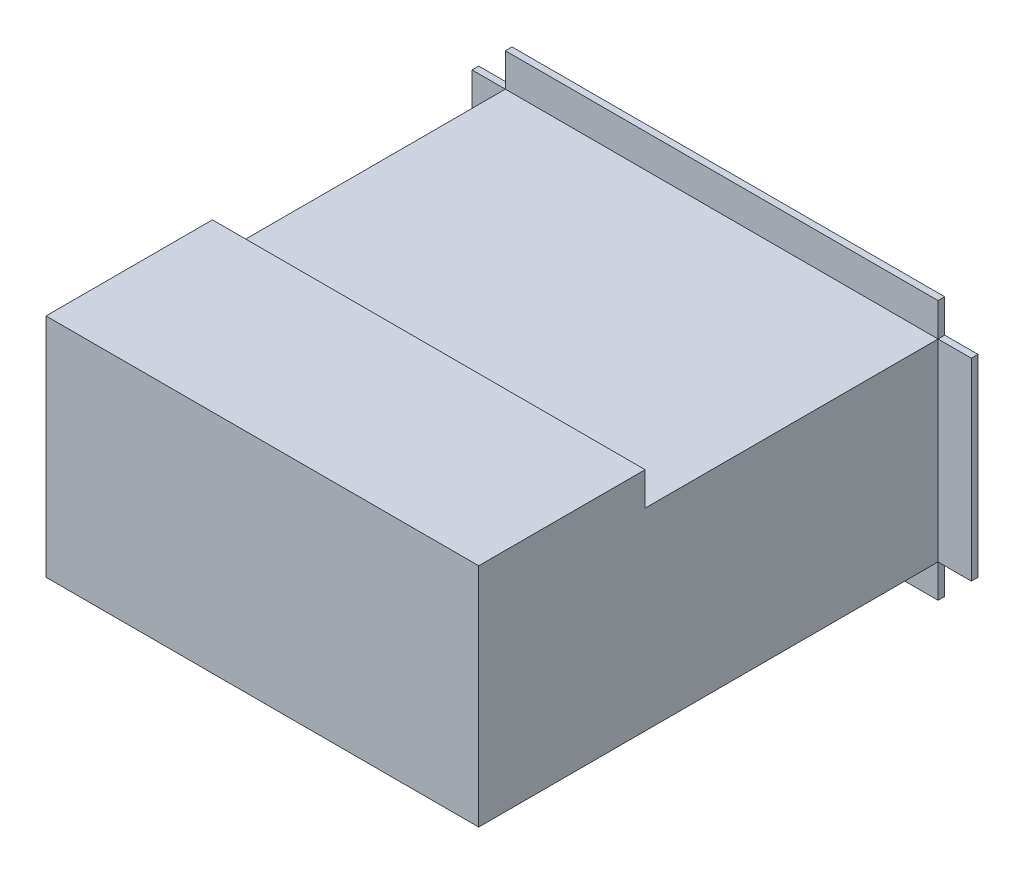
from build123d import *

# Parameters (mm, degrees)
SKETCH_1_W          = 13
SKETCH_1_H          = 6.8
EXTRUDE_1_DEPTH     = 14
SKETCH_3_W          = 13
SKETCH_3_H          = 8.8
CUT_EXTRUDE_1_DEPTH = 1
EXTRUDE_2_DEPTH     = 0.2
SKETCH_6_W          = 12.6
SKETCH_6_H          = 5.4
CUT_EXTRUDE_2_DEPTH = 9
SKETCH_7_W          = 10
SKETCH_7_H          = 2
EXTRUDE_3_DEPTH     = 8.5
CHAMFER_1_SIZE      = 0.5


with BuildPart() as part:
    # 草图1 → 拉伸1 (new body)
    with BuildSketch(Plane.XY):
        Rectangle(SKETCH_1_W, SKETCH_1_H)
    extrude(amount=EXTRUDE_1_DEPTH)

    # 草图3 → 切除-拉伸1 (cut)
    with BuildSketch(Plane(origin=(0, 3.4, 0), x_dir=(-1, 0, 0), z_dir=(0, 1, 0))):
        with Locations((0, 4.6)):
            Rectangle(SKETCH_3_W, SKETCH_3_H)
    extrude(amount=-CUT_EXTRUDE_1_DEPTH, mode=Mode.SUBTRACT)

    # 草图4 → 拉伸2 (add)
    with BuildSketch(Plane(origin=(0, 0, 0), x_dir=(-1, 0, 0), z_dir=(0, 0, -1))):
        Polygon((-7.5, 2.4), (7.5, 2.4), (7.5, -3.4), (6.5, -3.4), (6.5, -4.4), (-6.5, -4.4), (-6.5, -3.4), (-7.5, -3.400976197), align=None)
    extrude(amount=-EXTRUDE_2_DEPTH)

    # 草图6 → 切除-拉伸2 (cut)
    with BuildSketch(Plane(origin=(0, 0, 0), x_dir=(-1, 0, 0), z_dir=(0, 0, -1))):
        with Locations((0, -0.5)):
            Rectangle(SKETCH_6_W, SKETCH_6_H)
    extrude(amount=-CUT_EXTRUDE_2_DEPTH, mode=Mode.SUBTRACT)

    # 草图7 → 拉伸3 (add)
    with BuildSketch(Plane(origin=(0, 0, 9), x_dir=(-1, 0, 0), z_dir=(0, 0, -1))):
        with Locations((0, -1.2)):
            Rectangle(SKETCH_7_W, SKETCH_7_H)
    extrude(amount=EXTRUDE_3_DEPTH)

    # 倒角1
    chamfer_1_edges = [part.edges().sort_by_distance(p)[0] for p in [
        (0, -0.2, 0.5),
        (-5, -1.2, 0.5),
        (0, -2.2, 0.5),
        (5, -1.2, 0.5),
    ]]
    chamfer(chamfer_1_edges, length=CHAMFER_1_SIZE)


solid = part.part
